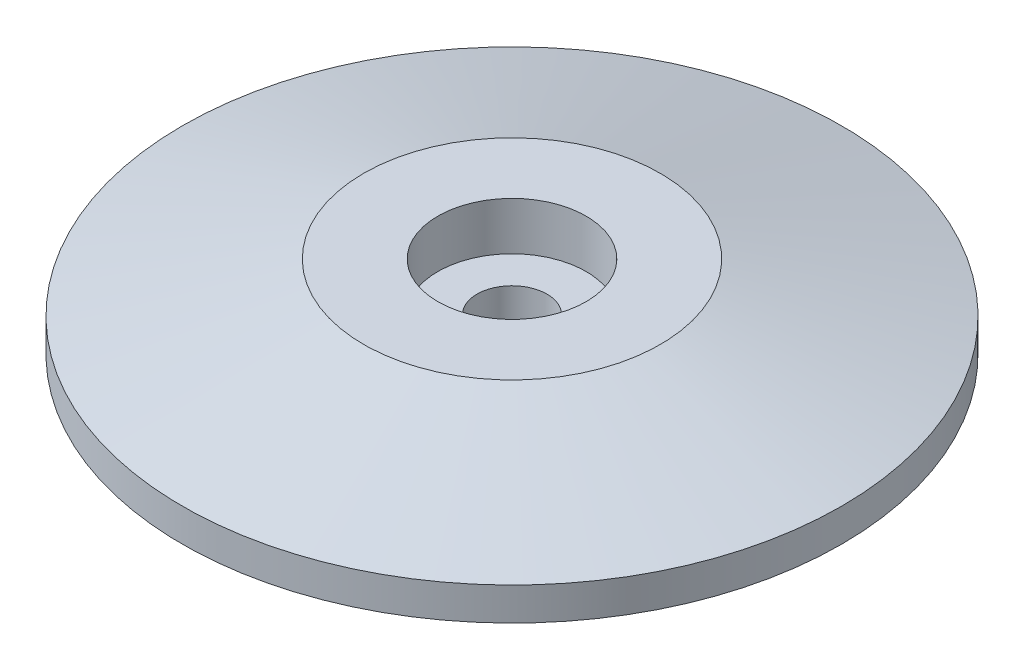
from build123d import *

# Parameters (mm, degrees)
SKETCH2_W                                = 4.7625
SKETCH2_H                                = 3.175
CBORE_FOR_1_2_HEX_HEAD_BOLT1_D           = 13.49248
CBORE_FOR_1_2_HEX_HEAD_BOLT1_CBORE_D     = 28.575
CBORE_FOR_1_2_HEX_HEAD_BOLT1_CBORE_DEPTH = 9.2456


with BuildPart() as part:
    # Sketch1 → Base-Revolve (revolve)
    with BuildSketch(Plane.XY, mode=Mode.PRIVATE) as base_revolve_sk:
        Polygon((0, 0), (63.5, 0), (63.5, 6.35), (28.575, 15.875), (0, 15.875), align=None)
    revolve(base_revolve_sk.sketch.rotate(Axis((0, 15.875, 0), (0, -1, 0)), 180), axis=Axis((0, 15.875, 0), (0, -1, 0)))

    # Sketch2 → Groove (revolve, cut)
    with BuildSketch(Plane.XY, mode=Mode.PRIVATE) as groove_sk:
        with Locations((29.36875, 1.5875)):
            Rectangle(SKETCH2_W, SKETCH2_H)
    revolve(groove_sk.sketch.rotate(Axis((0, 0, 0), (0, 1, 0)), 90), axis=Axis((0, 0, 0), (0, 1, 0)), mode=Mode.SUBTRACT)

    # CBORE for 1/2 Hex Head Bolt1 (through all)
    with Locations(Plane(origin=(0, 15.875, 0), x_dir=(-1, 0, 0), z_dir=(0, 1, 0))):
        with Locations((0, 0)):
            CounterBoreHole(CBORE_FOR_1_2_HEX_HEAD_BOLT1_D / 2, CBORE_FOR_1_2_HEX_HEAD_BOLT1_CBORE_D / 2, CBORE_FOR_1_2_HEX_HEAD_BOLT1_CBORE_DEPTH)


solid = part.part
